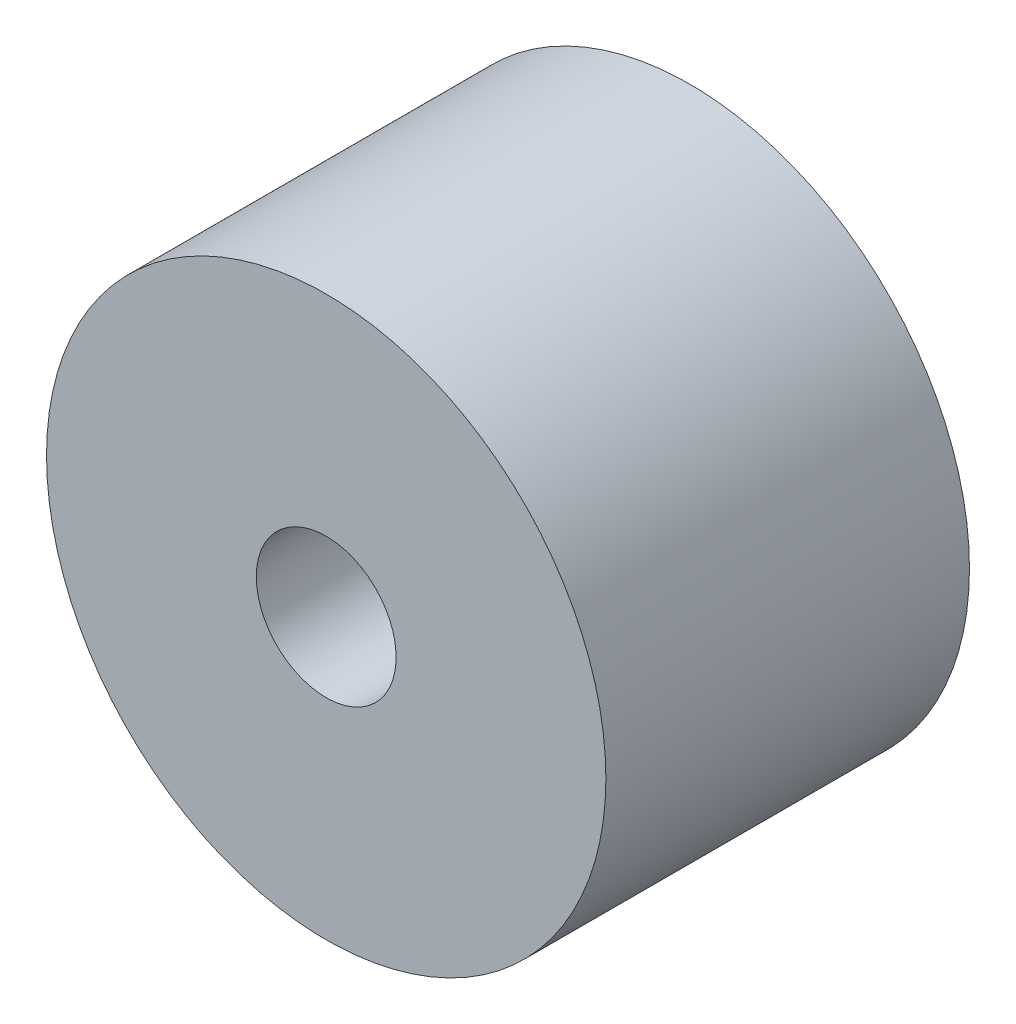
from build123d import *

# Parameters (mm, degrees)
SKETCH1_R           = 10
SKETCH1_R_2         = 8.060850601
SKETCH1_R_3         = 2.5
BOSS_EXTRUDE1_DEPTH = 13


with BuildPart() as part:
    # Sketch1 → Boss-Extrude1 (new body)
    # profile 1 of 2: a face of its own
    with BuildSketch(Plane.XY):
        with Locations(Location((0, 0, 0), (0, 0, 180))):
            Circle(SKETCH1_R)
        Circle(SKETCH1_R_2, mode=Mode.SUBTRACT)
    # profile 2 of 2: a face of its own
    with BuildSketch(Plane.XY):
        Circle(SKETCH1_R_2)
        with Locations(Location((0, 0, 0), (0, 0, 180))):
            Circle(SKETCH1_R_3, mode=Mode.SUBTRACT)
    extrude(amount=BOSS_EXTRUDE1_DEPTH)


solid = part.part
